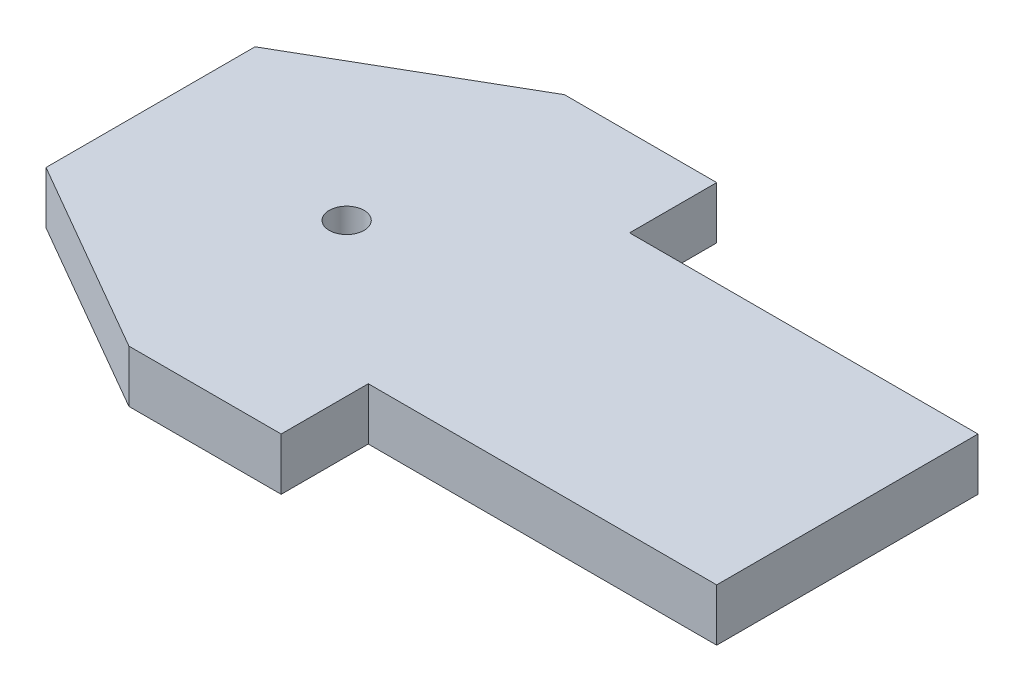
from build123d import *

# Parameters (mm, degrees)
BOSS_EXTRUDE1_DEPTH = 3
SKETCH2_R           = 1
CUT_EXTRUDE1_DEPTH  = 33


with BuildPart() as part:
    # Sketch1 → Boss-Extrude1 (new body)
    with BuildSketch(Plane(origin=(0, 0, 0), x_dir=(1, 0, 0), z_dir=(0, 1, 0))):
        Polygon((-10, 7.5), (-10, 12.5), (-18.741669751, 12.5), (-30, 6), (-30, -6), (-18.741669751, -12.5), (-10, -12.5), (-10, -7.5), (10, -7.5), (10, 7.5), align=None)
    extrude(amount=BOSS_EXTRUDE1_DEPTH)

    # Sketch2 → Cut-Extrude1 (cut)
    with BuildSketch(Plane(origin=(0, 3, 0), x_dir=(1, 0, 0), z_dir=(0, 1, 0))):
        with Locations(Location((-18.741669751, 0, 0), (0, 0, 270))):
            Circle(SKETCH2_R)
    extrude(amount=-CUT_EXTRUDE1_DEPTH, mode=Mode.SUBTRACT)


solid = part.part
